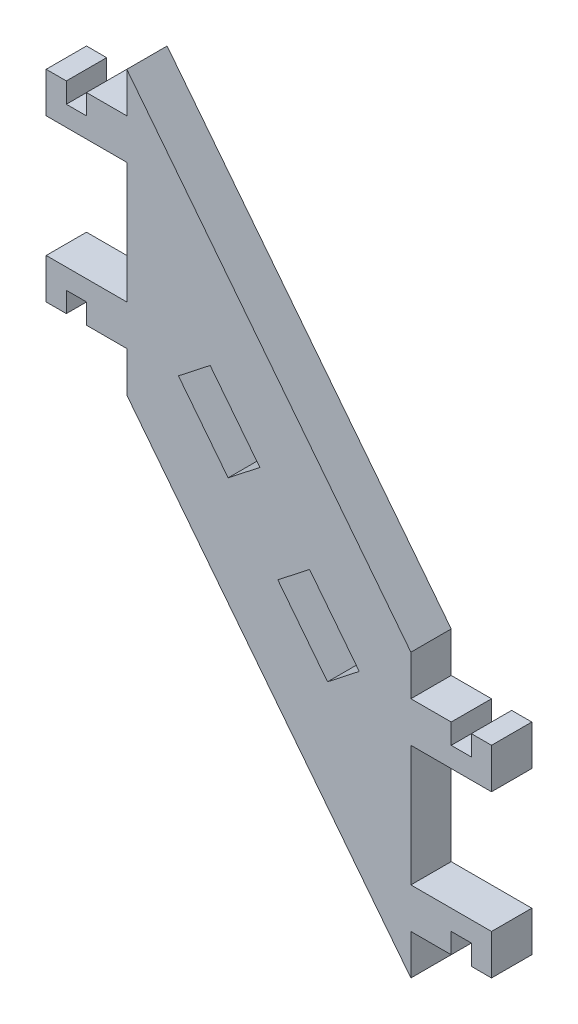
from build123d import *

# Parameters (mm, degrees)
PROFILE_DEPTH      = 6.35
CUT_EXTRUDE1_DEPTH = 99.192500569


with BuildPart() as part:
    # Sketch1 → Profile (new body)
    with BuildSketch(Plane.XY):
        Polygon((-44.7548, 79.375), (-44.7548, 73.025), (-51.1048, 73.025), (-51.1048, 69.841302271), (-54.2798, 69.841302271), (-54.2798, 73.025), (-57.4548, 73.025), (-57.4548, 66.675), (-44.7548, 66.675), (-44.7548, 47.625), (-57.4548, 47.625), (-57.4548, 41.275), (-54.2798, 41.275), (-54.2798, 44.458697729), (-51.1048, 44.458697729), (-51.1048, 41.275), (-44.7548, 41.275), (-44.7548, 34.925), (0, -22.225), (0, -15.875), (6.35, -15.875), (6.35, -12.691302271), (9.525, -12.691302271), (9.525, -15.875), (12.7, -15.875), (12.7, -9.525), (0, -9.525), (0, 9.525), (12.7, 9.525), (12.7, 15.875), (9.525, 15.875), (9.525, 12.691302271), (6.35, 12.691302271), (6.35, 15.875), (0, 15.875), (0, 22.225), align=None)
    extrude(amount=PROFILE_DEPTH)

    # Sketch2 → Cut-Extrude1 (cut, through all)
    with BuildSketch(Plane.XY.offset(6.35)):
        Polygon((-31.623026277, 45.530869772), (-36.622463702, 41.615754776), (-28.792233709, 31.616879926), (-23.792796284, 35.531994923), align=None)
        Polygon((-15.962566291, 25.533120074), (-8.132336298, 15.534245224), (-13.131773723, 11.619130228), (-20.962003716, 21.618005077), align=None)
    extrude(amount=-CUT_EXTRUDE1_DEPTH, mode=Mode.SUBTRACT)


solid = part.part
